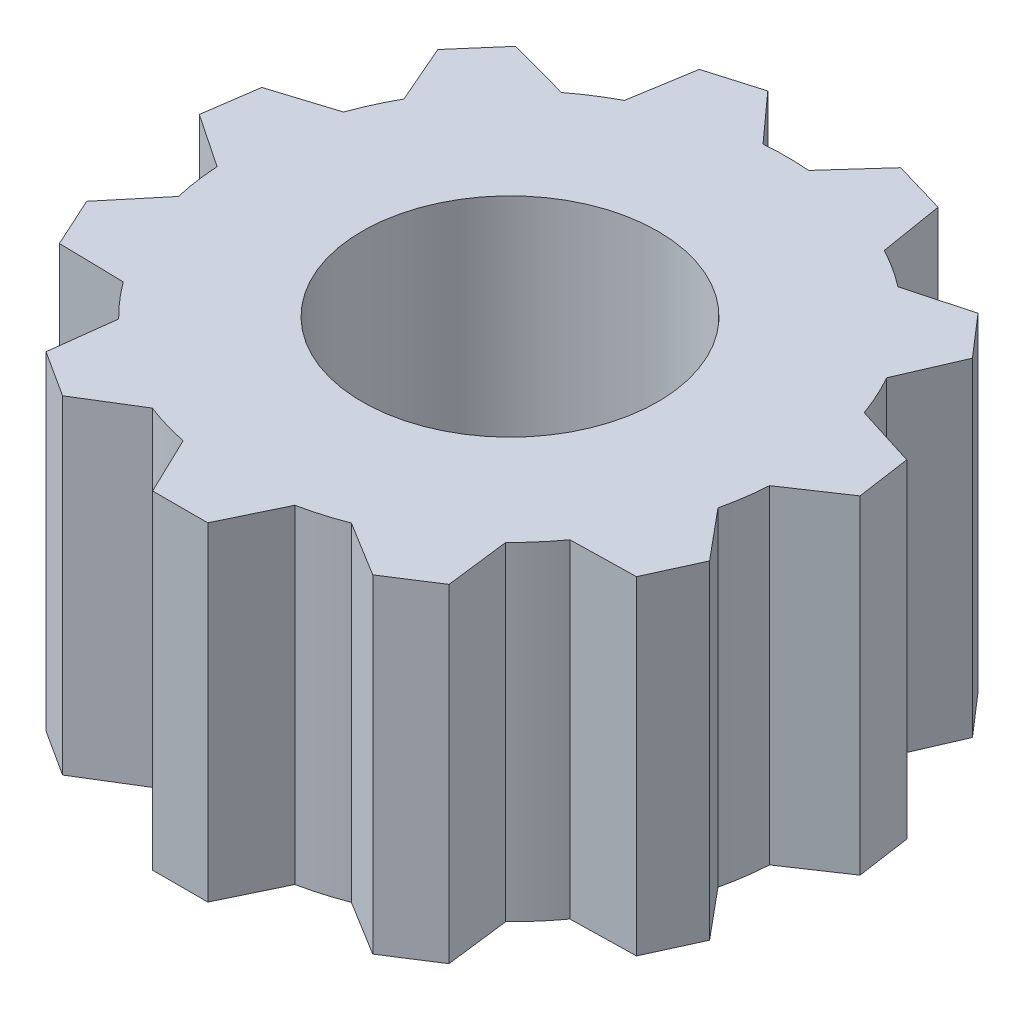
from build123d import *
from build123d.topology import SkipClean

# Parameters (mm, degrees)
SKETCH1_R            = 4.5
BOSS_EXTRUDE1_DEPTH  = 4.999999999999969
SKETCH12_R           = 8.425
SKETCH12_R_2         = 4.5
BOSS_EXTRUDE6_DEPTH  = 5
BOSS_EXTRUDE9_DEPTH  = 5
CIRPATTERN2_COUNT    = 11
BOSS_EXTRUDE10_START = 5
SKETCH17_R           = 8.425
SKETCH17_R_2         = 4.5
BOSS_EXTRUDE10_DEPTH = 5
BOSS_EXTRUDE11_DEPTH = 5
SKETCH19_R           = 4.5
CUT_EXTRUDE1_DEPTH   = 10


with BuildPart() as part:
    # Sketch1 → Boss-Extrude1 (new body)
    with BuildSketch(Plane(origin=(0, 0, 0), x_dir=(1, 0, 0), z_dir=(0, 1, 0))):
        with Locations(Location((0, 0, 0), (0, 0, 270))):
            Circle(SKETCH1_R)
    extrude(amount=BOSS_EXTRUDE1_DEPTH)

    # Sketch19 → Cut-Extrude1 (cut)
    with BuildSketch(Plane.XZ):
        with Locations(Location((0, 0, 0), (0, 0, 270))):
            Circle(SKETCH19_R)
    extrude(amount=-CUT_EXTRUDE1_DEPTH, mode=Mode.SUBTRACT)


with BuildPart() as body_2:
    # Sketch12 → Boss-Extrude6 (new body)
    with BuildSketch(Plane(origin=(0, 5, 0), x_dir=(-1, 0, 0), z_dir=(0, -1, 0))):
        with Locations(Location((0, 0, 0), (0, 0, 90))):
            Circle(SKETCH12_R)
        with Locations(Location((0, 0, 0), (0, 0, 270))):
            Circle(SKETCH12_R_2, mode=Mode.SUBTRACT)
    extrude(amount=BOSS_EXTRUDE6_DEPTH)



with BuildPart() as body_3:
    # Sketch13 → Boss-Extrude9 (new body)
    with BuildSketch(Plane.XZ):
        with BuildLine():
            Line((1.700000000000002, 8.251704369401512), (0.84, 10.039921563438629))
            Line((0.84, 10.039921563438629), (-0.84, 10.039921563438629))
            Line((-0.84, 10.039921563438629), (-1.6999999999999977, 8.251704369401512))
            ThreePointArc((-1.6999999999999977, 8.251704369401514), (2.39e-15, 8.425), (1.7000000000000024, 8.251704369401512))
        make_face()
    extrude(amount=-BOSS_EXTRUDE9_DEPTH)


with BuildPart() as cirpattern2_1:
    # CirPattern2: pattern copy
    add(body_3.part.rotate(Axis((-9e-17, 0, -3.9e-16), (0, 1, 0)), 1 * 360 / CIRPATTERN2_COUNT))


with BuildPart() as cirpattern2_2:
    # CirPattern2: pattern copy
    add(body_3.part.rotate(Axis((-9e-17, 0, -3.9e-16), (0, 1, 0)), 2 * 360 / CIRPATTERN2_COUNT))


with BuildPart() as cirpattern2_3:
    # CirPattern2: pattern copy
    add(body_3.part.rotate(Axis((-9e-17, 0, -3.9e-16), (0, 1, 0)), 3 * 360 / CIRPATTERN2_COUNT))


with BuildPart() as cirpattern2_4:
    # CirPattern2: pattern copy
    add(body_3.part.rotate(Axis((-9e-17, 0, -3.9e-16), (0, 1, 0)), 4 * 360 / CIRPATTERN2_COUNT))


with BuildPart() as cirpattern2_5:
    # CirPattern2: pattern copy
    add(body_3.part.rotate(Axis((-9e-17, 0, -3.9e-16), (0, 1, 0)), 5 * 360 / CIRPATTERN2_COUNT))


with BuildPart() as cirpattern2_6:
    # CirPattern2: pattern copy
    add(body_3.part.rotate(Axis((-9e-17, 0, -3.9e-16), (0, 1, 0)), 6 * 360 / CIRPATTERN2_COUNT))


with BuildPart() as cirpattern2_7:
    # CirPattern2: pattern copy
    add(body_3.part.rotate(Axis((-9e-17, 0, -3.9e-16), (0, 1, 0)), 7 * 360 / CIRPATTERN2_COUNT))


with BuildPart() as cirpattern2_8:
    # CirPattern2: pattern copy
    add(body_3.part.rotate(Axis((-9e-17, 0, -3.9e-16), (0, 1, 0)), 8 * 360 / CIRPATTERN2_COUNT))


with BuildPart() as cirpattern2_9:
    # CirPattern2: pattern copy
    add(body_3.part.rotate(Axis((-9e-17, 0, -3.9e-16), (0, 1, 0)), 9 * 360 / CIRPATTERN2_COUNT))


with BuildPart() as cirpattern2_10:
    # CirPattern2: pattern copy
    add(body_3.part.rotate(Axis((-9e-17, 0, -3.9e-16), (0, 1, 0)), 10 * 360 / CIRPATTERN2_COUNT))


with BuildPart() as body_2_1:
    with SkipClean():  # the faces are left unmerged after this step: merging them gives an invalid solid
        add(body_2.part)

        add(body_3.part)  # Boss-Extrude10 merges body 3

        add(cirpattern2_2.part)  # Boss-Extrude10 merges CirPattern2_2

        add(cirpattern2_3.part)  # Boss-Extrude10 merges CirPattern2_3

        add(cirpattern2_4.part)  # Boss-Extrude10 merges CirPattern2_4

        add(cirpattern2_5.part)  # Boss-Extrude10 merges CirPattern2_5

        add(cirpattern2_6.part)  # Boss-Extrude10 merges CirPattern2_6

        add(cirpattern2_7.part)  # Boss-Extrude10 merges CirPattern2_7

        add(cirpattern2_8.part)  # Boss-Extrude10 merges CirPattern2_8

        add(cirpattern2_9.part)  # Boss-Extrude10 merges CirPattern2_9

        add(cirpattern2_10.part)  # Boss-Extrude10 merges CirPattern2_10
        # Sketch17 → Boss-Extrude10 (add)
        # profile 1 of 11: a face of its own
        with BuildSketch(Plane.XZ.offset(BOSS_EXTRUDE10_START)):
            Circle(SKETCH17_R)
            with Locations(Location((0, 0, 0), (0, 0, 90))):
                Circle(SKETCH17_R_2, mode=Mode.SUBTRACT)
        # profile 2 of 11: a face of its own
        with BuildSketch(Plane.XZ.offset(BOSS_EXTRUDE10_START)):
            with BuildLine():
                ThreePointArc((-1.6999999999999988, 8.251704369401518), (2.05e-15, 8.425000000000002), (1.7000000000000028, 8.251704369401514))
                Line((1.7000000000000024, 8.251704369401512), (0.8400000000000013, 10.039921563438629))
                Line((0.8400000000000013, 10.039921563438629), (-0.8400000000000009, 10.039921563438629))
                Line((-0.8400000000000009, 10.039921563438629), (-1.6999999999999984, 8.251704369401514))
            make_face()
        # profile 3 of 11: a face of its own
        with BuildSketch(Plane.XZ.offset(BOSS_EXTRUDE10_START)):
            with BuildLine():
                ThreePointArc((-5.891339201488175, 6.022686062962995), (-4.554898887063417, 7.087561014102698), (-3.0310771898621596, 7.860864842312031))
                Line((-3.03107718986216, 7.860864842312031), (-4.72133843366936, 8.9002577712534))
                Line((-4.72133843366936, 8.9002577712534), (-6.134644368825746, 7.991981197927994))
                Line((-6.134644368825746, 7.991981197927994), (-5.891339201488176, 6.022686062962995))
            make_face()
        # profile 4 of 11: a face of its own
        with BuildSketch(Plane.XZ.offset(BOSS_EXTRUDE10_START)):
            with BuildLine():
                Line((-9.481582495875129, 3.4066432707159575), (-8.212219832717508, 1.8815074857999516))
                ThreePointArc((-8.21221983271751, 1.8815074857999512), (-7.663649560861826, 3.4998714845408747), (-6.7998087885111005, 4.974256270005318))
                Line((-6.7998087885111, 4.974256270005317), (-8.783685274031965, 4.934825022911553))
                Line((-8.783685274031965, 4.934825022911553), (-9.481582495875129, 3.4066432707159575))
            make_face()
        # profile 5 of 11: a face of its own
        with BuildSketch(Plane.XZ.offset(BOSS_EXTRUDE10_START)):
            with BuildLine():
                Line((-9.818185174144725, -2.260279824757259), (-7.925778691831604, -2.8570364240079513))
                ThreePointArc((-7.925778691831604, -2.857036424007951), (-8.339245647846854, -1.1990025124524568), (-8.409649141960784, 0.5083564783872193))
                Line((-8.409649141960784, 0.5083564783872193), (-10.057274102443852, -0.5973798023972904))
                Line((-10.057274102443852, -0.5973798023972905), (-9.818185174144725, -2.260279824757259))
            make_face()
        # profile 6 of 11: a face of its own
        with BuildSketch(Plane.XZ.offset(BOSS_EXTRUDE10_START)):
            with BuildLine():
                Line((-7.037583431604806, -7.20958004624413), (-5.1229588171653475, -6.688491456048056))
                ThreePointArc((-5.1229588171653475, -6.688491456048055), (-6.367190163934598, -5.517201683489059), (-7.349485312579329, -4.118942903243587))
                Line((-7.34948531257933, -4.118942903243588), (-8.137749464632893, -5.93992076132898))
                Line((-8.137749464632893, -5.93992076132898), (-7.037583431604806, -7.20958004624413))
            make_face()
        # profile 7 of 11: a face of its own
        with BuildSketch(Plane.XZ.offset(BOSS_EXTRUDE10_START)):
            with BuildLine():
                Line((-2.022598674718725, -9.869889543506861), (-0.6936357151463852, -8.396397709415234))
                ThreePointArc((-0.6936357151463853, -8.396397709415236), (-2.3735967913889944, -8.08372830270216), (-3.955911825435684, -7.4385070161543965))
                Line((-3.9559118254356838, -7.438507016154395), (-3.634546870391086, -9.39657884801327))
                Line((-3.634546870391086, -9.39657884801327), (-2.022598674718725, -9.869889543506861))
            make_face()
        # profile 8 of 11: a face of its own
        with BuildSketch(Plane.XZ.offset(BOSS_EXTRUDE10_START)):
            with BuildLine():
                Line((3.6345468703912207, -9.396578848013215), (3.955911825435787, -7.438507016154339))
                ThreePointArc((3.955911825435787, -7.438507016154339), (2.3735967913891054, -8.083728302702124), (0.6936357151465026, -8.396397709415222))
                Line((0.6936357151465024, -8.396397709415224), (2.022598674718867, -9.86988954350683))
                Line((2.022598674718867, -9.86988954350683), (3.6345468703912207, -9.396578848013215))
            make_face()
        # profile 9 of 11: a face of its own
        with BuildSketch(Plane.XZ.offset(BOSS_EXTRUDE10_START)):
            with BuildLine():
                Line((5.122958817165441, -6.688491456047983), (7.037583431604909, -7.209580046244029))
                Line((7.037583431604909, -7.209580046244029), (8.137749464632977, -5.939920761328863))
                Line((8.137749464632977, -5.939920761328863), (7.349485312579388, -4.118942903243486))
                ThreePointArc((7.349485312579388, -4.118942903243488), (6.367190163934675, -5.51720168348897), (5.122958817165442, -6.6884914560479825))
            make_face()
        # profile 10 of 11: a face of its own
        with BuildSketch(Plane.XZ.offset(BOSS_EXTRUDE10_START)):
            with BuildLine():
                ThreePointArc((8.425, 5e-16), (8.299256306401244, -1.4501619773870813), (7.925778691831642, -2.8570364240078403))
                Line((7.925778691831642, -2.8570364240078403), (9.818185174144755, -2.260279824757118))
                Line((9.818185174144755, -2.260279824757118), (10.05727410244386, -0.5973798023971462))
                Line((10.05727410244386, -0.597379802397146), (8.409649141960777, 0.5083564783873361))
                ThreePointArc((8.409649141960777, 0.508356478387336), (8.42116141102341, 0.25429410038423766), (8.425, 5e-16))
            make_face()
        # profile 11 of 11: a face of its own
        with BuildSketch(Plane.XZ.offset(BOSS_EXTRUDE10_START)):
            with BuildLine():
                ThreePointArc((6.79980878851103, 4.974256270005415), (7.663649560861776, 3.499871484540982), (8.21221983271748, 1.8815074858000667))
                Line((8.21221983271748, 1.8815074858000667), (9.481582495875081, 3.4066432707160943))
                Line((9.481582495875081, 3.4066432707160943), (8.783685274031892, 4.934825022911679))
                Line((8.783685274031892, 4.934825022911679), (6.799808788511031, 4.974256270005414))
            make_face()
        extrude(amount=-BOSS_EXTRUDE10_DEPTH)


    add(cirpattern2_1.part)  # Boss-Extrude11 merges CirPattern2_1
    # Sketch18 → Boss-Extrude11 (add)
    with BuildSketch(Plane.XZ):
        with BuildLine():
            Line((6.1346443688256285, 7.991981197928084), (4.721338433669231, 8.900257771253472))
            Line((4.721338433669231, 8.900257771253472), (3.031077189862048, 7.860864842312075))
            ThreePointArc((3.031077189862048, 7.860864842312075), (4.554898887063315, 7.087561014102763), (5.891339201488088, 6.022686062963079))
            Line((5.891339201488088, 6.022686062963079), (6.1346443688256285, 7.991981197928084))
        make_face()
    extrude(amount=BOSS_EXTRUDE11_DEPTH)


solid = body_2_1.part
